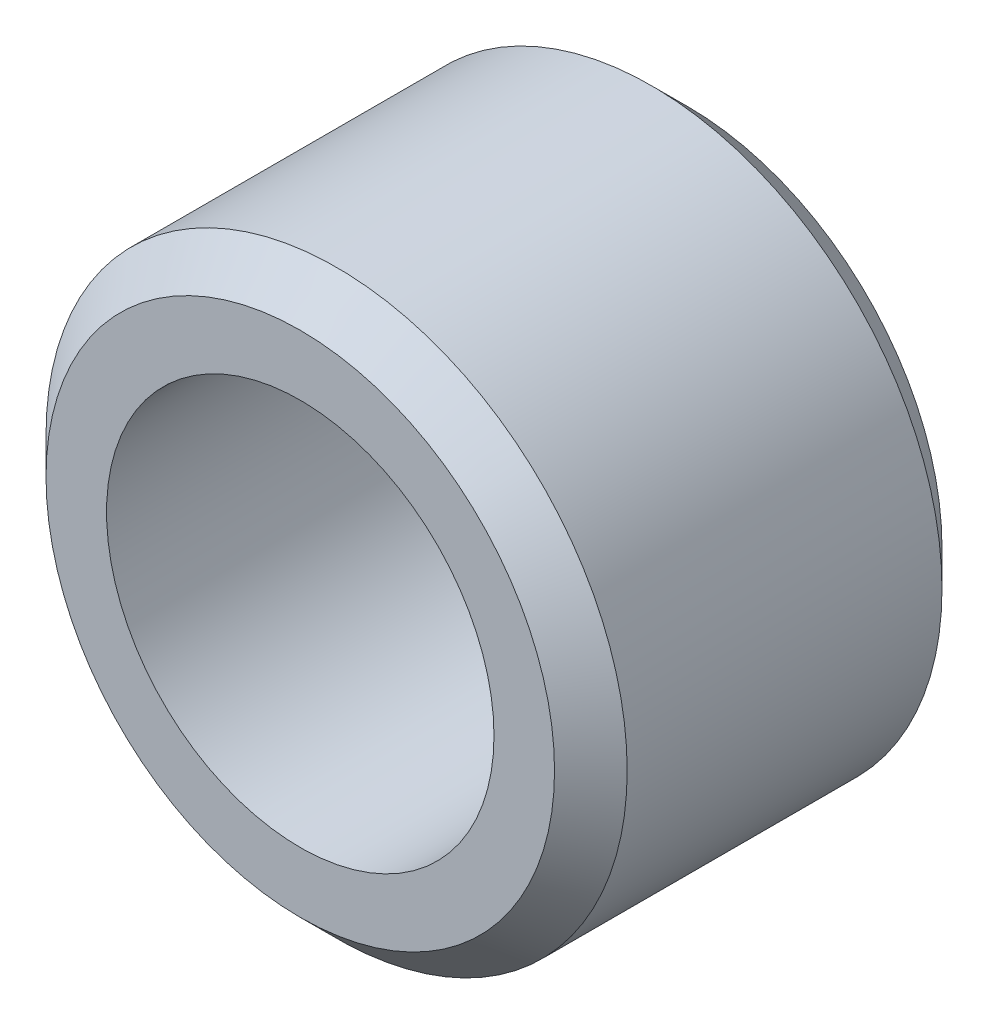
from build123d import *

# Parameters (mm, degrees)
SKETCH3_W     = 6.35
SKETCH3_H     = 1.5875
CHAMFER1_SIZE = 0.5953125


with BuildPart() as part:
    # Sketch3 → Revolve1 (revolve)
    with BuildSketch(Plane(origin=(0, 0, 0), x_dir=(0, 0, -1), z_dir=(1, 0, 0)), mode=Mode.PRIVATE) as revolve1_sk:
        with Locations((0, 3.96875)):
            Rectangle(SKETCH3_W, SKETCH3_H)
    revolve(revolve1_sk.sketch.rotate(Axis((0, 0, 3.175), (0, 0, -1)), 90), axis=Axis((0, 0, 3.175), (0, 0, -1)))

    # Chamfer1
    chamfer1_edges = [part.edges().sort_by_distance(p)[0] for p in [
        (-4.7625, 0, 3.175),
        (-4.7625, 0, -3.175),
    ]]
    chamfer(chamfer1_edges, length=CHAMFER1_SIZE)


solid = part.part
